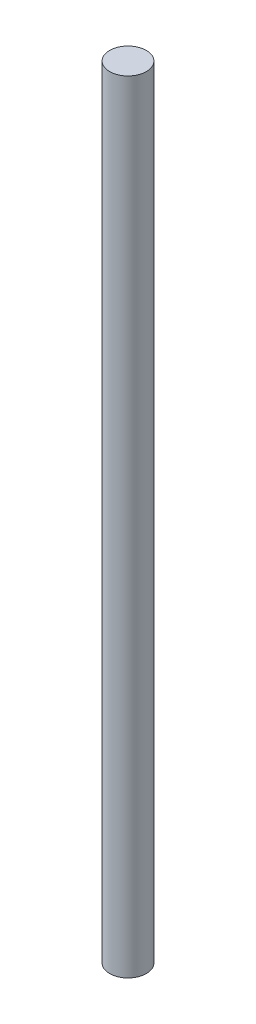
from build123d import *

# Parameters (mm, degrees)
SKETCH1_R           = 6.2
BOSS_EXTRUDE1_DEPTH = 264


with BuildPart() as part:
    # Sketch1 → Boss-Extrude1 (new body)
    with BuildSketch(Plane(origin=(0, 0, 0), x_dir=(1, 0, 0), z_dir=(0, 1, 0))):
        with Locations(Location((0, 0, 0), (0, 0, 270))):
            Circle(SKETCH1_R)
    extrude(amount=BOSS_EXTRUDE1_DEPTH)


solid = part.part
